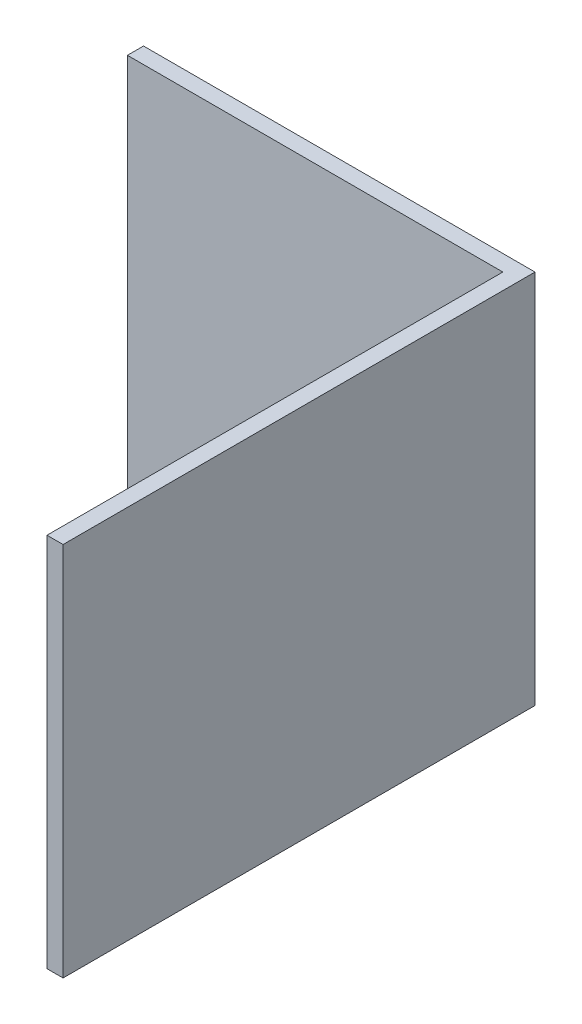
from build123d import *

# Parameters (mm, degrees)
BOSS_EXTRUDE1_DEPTH = 70


with BuildPart() as part:
    # Sketch1 → Boss-Extrude1 (new body)
    with BuildSketch(Plane(origin=(0, 0, 0), x_dir=(1, 0, 0), z_dir=(0, 1, 0))):
        Polygon((-57.947368421, 6.447368421), (12.052631579, 6.447368421), (12.052631579, -78.552631579), (15.052631579, -78.552631579), (15.052631579, 9.447368421), (-57.947368421, 9.447368421), align=None)
    extrude(amount=BOSS_EXTRUDE1_DEPTH)


solid = part.part
